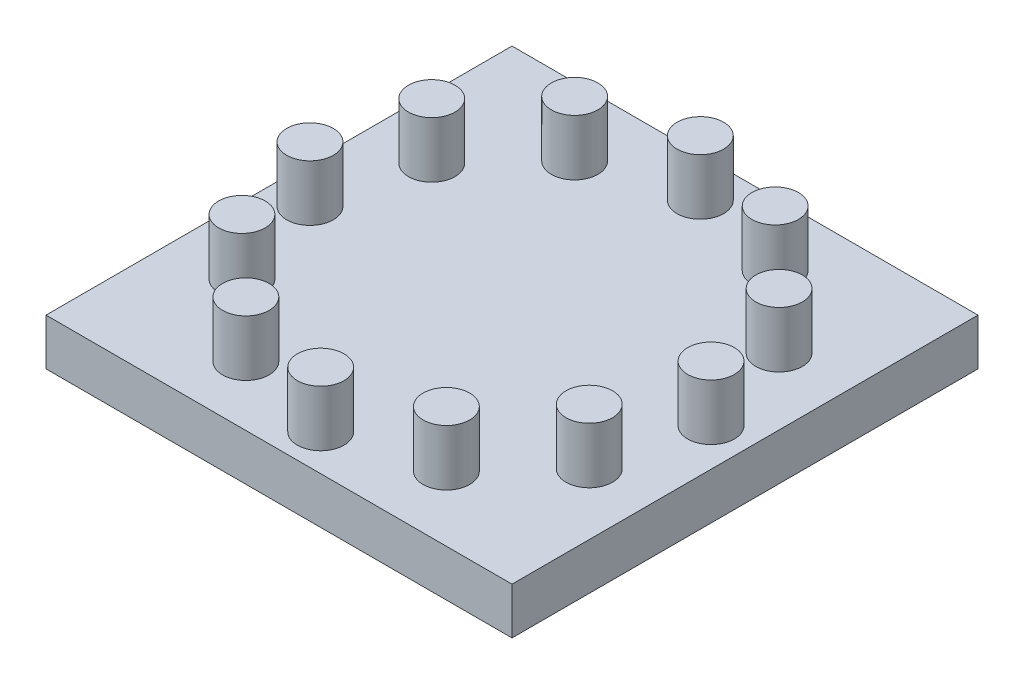
from build123d import *

# Parameters (mm, degrees)
CROQUIS1_W              = 100
CROQUIS1_H              = 100
SALIENTE_EXTRUIR1_DEPTH = 10
CROQUIS2_R              = 5
SALIENTE_EXTRUIR2_DEPTH = 12
MATRIZC1_COUNT          = 12


with BuildPart() as part:
    # Croquis1 → Saliente-Extruir1 (new body)
    with BuildSketch(Plane(origin=(0, 0, 0), x_dir=(1, 0, 0), z_dir=(0, 1, 0))):
        Rectangle(CROQUIS1_W, CROQUIS1_H)
    extrude(amount=SALIENTE_EXTRUIR1_DEPTH)

    # Croquis2 → Saliente-Extruir2 (add)
    with BuildSketch(Plane(origin=(0, 10, 0), x_dir=(1, 0, 0), z_dir=(0, 1, 0))):
        with Locations(Location((-1.140405964, 41.553542307, 0), (0, 0, 270))):
            Circle(CROQUIS2_R)
    saliente_extruir2 = extrude(amount=SALIENTE_EXTRUIR2_DEPTH)

    # MatrizC1: Saliente-Extruir2 ×12 about axis
    matrizc1_axis = Axis((0.00902763, 0, 0.32894428), (0, 1, 0))
    for i in range(1, MATRIZC1_COUNT):
        add(saliente_extruir2.rotate(matrizc1_axis, i * 360 / MATRIZC1_COUNT))


solid = part.part
